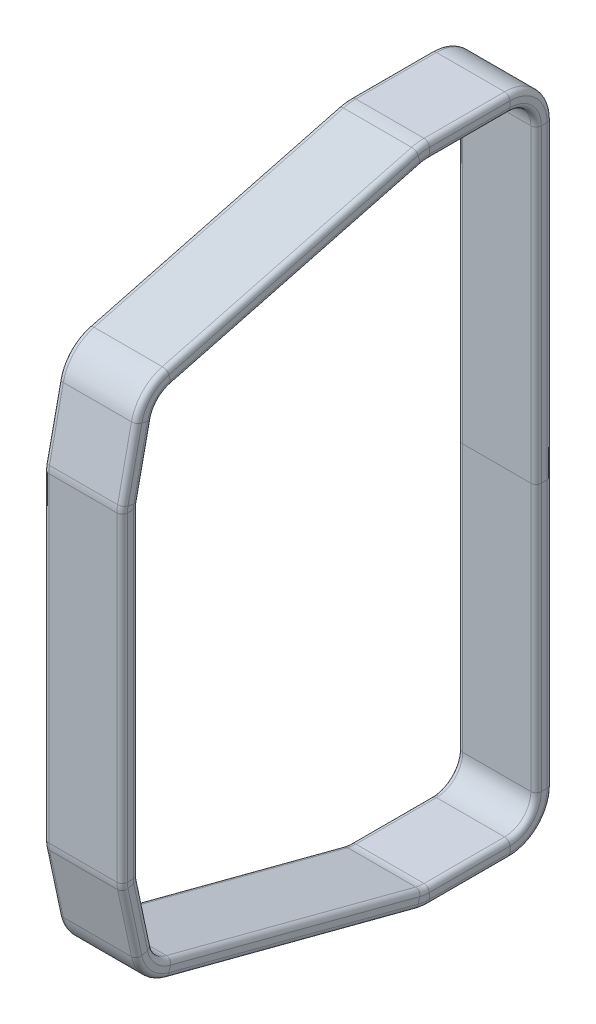
from build123d import *

# Parameters (mm, degrees)
SKETCH3_W = 7.62
SKETCH3_H = 1.5875
FILLET1_R = 0.508


with BuildPart() as part:
    # Sweep1: sweep along a path in Sketch2
    with BuildLine(Plane(origin=(-39.099532927, 0, 0), x_dir=(0, 0, -1), z_dir=(1, 0, 0))) as sweep1_path:
        Line((0.8255, -25.883657999), (0.8255, 29.996342001))
        ThreePointArc((0.8255, 29.996342001), (0.081551224, 31.792393225), (-1.7145, 32.536342001))
        Line((-1.7145, 32.536342001), (-9.525, 32.536342001))
        ThreePointArc((-9.525, 32.536342001), (-9.930637017, 32.510323362), (-10.329625768, 32.432693881))
        Line((-10.329625768, 32.432693881), (-34.489200615, 26.103423505))
        ThreePointArc((-34.489200615, 26.103423505), (-35.683232492, 25.399721391), (-36.330095218, 24.173965541))
        Line((-36.330095218, 24.173965541), (-37.665372012, 17.886106714))
        ThreePointArc((-37.665372012, 17.886106714), (-37.691319269, 17.72213092), (-37.7, 17.556342001))
        Line((-37.7, 17.556342001), (-37.7, -13.443657999))
        ThreePointArc((-37.7, -13.443657999), (-37.691319269, -13.609446919), (-37.665372012, -13.773422712))
        Line((-37.665372012, -13.773422712), (-36.330095218, -20.061281539))
        ThreePointArc((-36.330095218, -20.061281539), (-35.683232492, -21.287037389), (-34.489200615, -21.990739503))
        Line((-34.489200615, -21.990739503), (-10.329625768, -28.320009879))
        ThreePointArc((-10.329625768, -28.320009879), (-9.930637017, -28.39763936), (-9.525, -28.423657999))
        Line((-9.525, -28.423657999), (-1.7145, -28.423657999))
        ThreePointArc((-1.7145, -28.423657999), (0.081551224, -27.679709223), (0.8255, -25.883657999))
    # Sketch3 → Sweep1 (sweep)
    with BuildSketch(Plane(origin=(0, 0, 0), x_dir=(1, 0, 0), z_dir=(0, 1, 0))):
        with Locations((-39.099532927, 1.61925)):
            Rectangle(SKETCH3_W, SKETCH3_H)
    sweep(path=sweep1_path.line)

    # Fillet1
    fillet1_edges = [part.edges().sort_by_distance(p)[0] for p in [
        (-35.289532927, -26.691050632, 22.811726076),
        (-42.909532927, -26.691050632, 22.811726076),
        (-42.909532927, -25.155374691, 22.409413191),
        (-35.289532927, -21.287037389, 35.683232492),
        (-35.289532927, -22.382899508, 36.8318153),
        (-42.909532927, -22.382899508, 36.8318153),
        (-42.909532927, -21.287037389, 35.683232492),
        (-35.289532927, -16.917352126, 36.997733615),
        (-35.289532927, -17.247116838, 38.550605627),
        (-42.909532927, -17.247116838, 38.550605627),
        (-42.909532927, -16.917352126, 36.997733615),
        (-35.289532927, -13.609446919, 37.691319269),
        (-35.289532927, -13.775235838, 39.270138538),
        (-42.909532927, -13.775235838, 39.270138538),
        (-35.289532927, 2.056342001, -0.8255),
        (-42.909532927, -13.609446919, 37.691319269),
        (-35.289532927, 2.056342001, 37.7),
        (-35.289532927, 2.056342001, 39.2875),
        (-42.909532927, 2.056342001, 39.2875),
        (-42.909532927, 2.056342001, 37.7),
        (-35.289532927, 2.056342001, -2.413),
        (-35.289532927, 17.72213092, 37.691319269),
        (-35.289532927, 17.88791984, 39.270138538),
        (-42.909532927, 17.88791984, 39.270138538),
        (-42.909532927, 17.72213092, 37.691319269),
        (-35.289532927, 21.030036127, 36.997733615),
        (-35.289532927, 21.35980084, 38.550605627),
        (-42.909532927, 21.35980084, 38.550605627),
        (-42.909532927, 2.056342001, -2.413),
        (-42.909532927, 21.030036127, 36.997733615),
        (-35.289532927, 25.399721391, 35.683232492),
        (-35.289532927, 26.49558351, 36.8318153),
        (-42.909532927, 26.49558351, 36.8318153),
        (-42.909532927, 25.399721391, 35.683232492),
        (-35.289532927, 29.268058693, 22.409413191),
        (-35.289532927, 30.803734633, 22.811726076),
        (-42.909532927, 30.803734633, 22.811726076),
        (-42.909532927, 29.268058693, 22.409413191),
        (-35.289532927, 32.510323362, 9.930637017),
        (-42.909532927, 2.056342001, -0.8255),
        (-35.289532927, 34.084814042, 10.133455526),
        (-42.909532927, 34.084814042, 10.133455526),
        (-42.909532927, 32.510323362, 9.930637017),
        (-35.289532927, 32.536342001, 5.61975),
        (-35.289532927, 34.123842001, 5.61975),
        (-42.909532927, 34.123842001, 5.61975),
        (-42.909532927, 32.536342001, 5.61975),
        (-35.289532927, 31.792393225, -0.081551224),
        (-35.289532927, 32.91492524, -1.204083239),
        (-42.909532927, 32.91492524, -1.204083239),
        (-42.909532927, 31.792393225, -0.081551224),
        (-35.289532927, 2.056342001, -0.8255),
        (-35.289532927, 2.056342001, -2.413),
        (-42.909532927, 2.056342001, -2.413),
        (-42.909532927, 2.056342001, -0.8255),
        (-35.289532927, -27.679709223, -0.081551224),
        (-35.289532927, -28.802241238, -1.204083239),
        (-42.909532927, -28.802241238, -1.204083239),
        (-42.909532927, -27.679709223, -0.081551224),
        (-35.289532927, -28.423657999, 5.61975),
        (-35.289532927, -30.011157999, 5.61975),
        (-42.909532927, -30.011157999, 5.61975),
        (-42.909532927, -28.423657999, 5.61975),
        (-35.289532927, -28.39763936, 9.930637017),
        (-35.289532927, -29.97213004, 10.133455526),
        (-42.909532927, -29.97213004, 10.133455526),
        (-42.909532927, -28.39763936, 9.930637017),
        (-35.289532927, -25.155374691, 22.409413191),
    ]]
    fillet(fillet1_edges, radius=FILLET1_R)


solid = part.part
